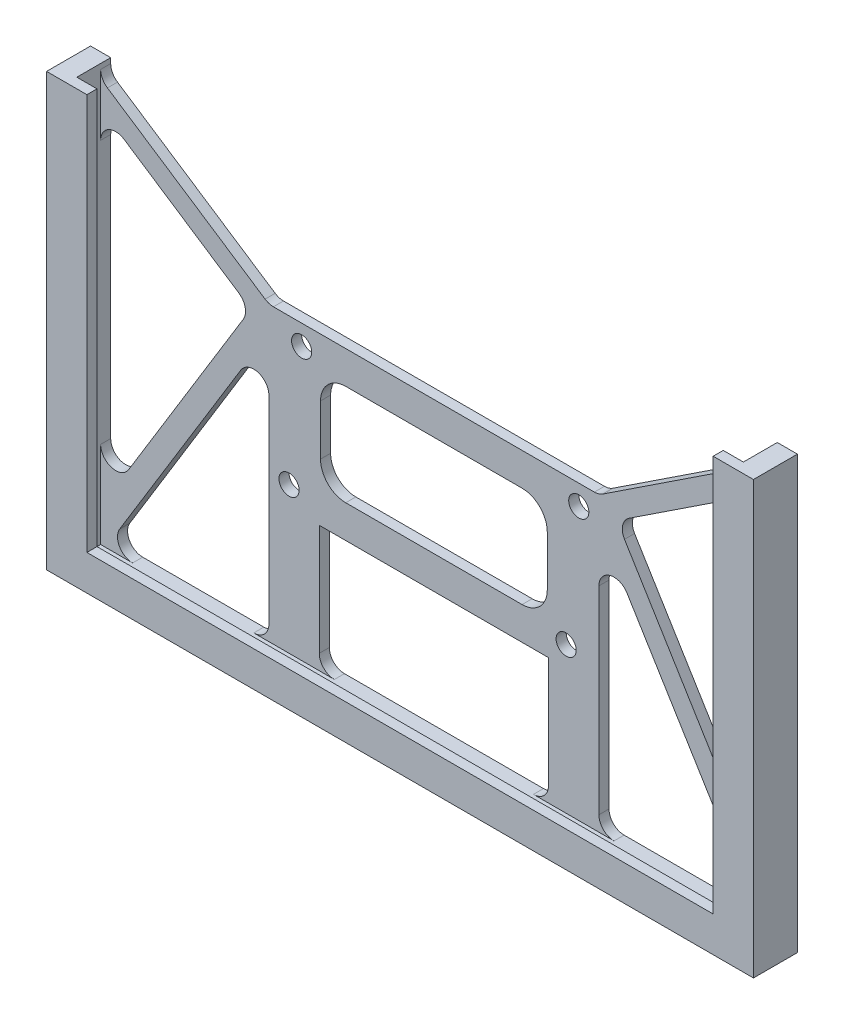
from build123d import *

# Parameters (mm, degrees)
SKETCH1_W                    = 83.185
SKETCH1_H                    = 41.91
SKETCH1_R                    = 2.54
SKETCH1_W_2                  = 57.15
SKETCH1_H_2                  = 25.4
ROVER_MOUNT_DEPTH            = 2.54
SIDE_WALLS_REACH             = 85.531
SIDE_WALLS_DIRECTION_2_DEPTH = 6.000000034
BACK_BRACES_DEPTH            = 2.54
FRONT_COVER_DEPTH            = 2.54
SKETCH5_W                    = 83.185
SKETCH5_H                    = 6.000000034
CLEANUP_DEPTH                = 31.75
FILLET1_R                    = 3.81
FILLET2_R                    = 6.35


with BuildPart() as part:
    # Sketch1 → Rover mount (new body)
    with BuildSketch(Plane.XY):
        with Locations((33.3375, -15.875)):
            Rectangle(SKETCH1_W, SKETCH1_H)
        with Locations((66.675, -31.75)):
            Circle(SKETCH1_R, mode=Mode.SUBTRACT)
        with Locations((69.85, 0)):
            Circle(SKETCH1_R, mode=Mode.SUBTRACT)
        with Locations((-3.175, -31.75)):
            Circle(SKETCH1_R, mode=Mode.SUBTRACT)
        Circle(SKETCH1_R, mode=Mode.SUBTRACT)
        with Locations((33.3375, -15.875)):
            Rectangle(SKETCH1_W_2, SKETCH1_H_2, mode=Mode.SUBTRACT)
    extrude(amount=ROVER_MOUNT_DEPTH)

    # Side Walls: up to this face of the body (flat: up to its plane)
    side_walls_end = Plane(part.part.faces().sort_by_distance((73.998539194, -15.875, 0))[0])
    # Sketch2 → Side Walls (add, up to the picked face)
    with BuildSketch(Plane.XY.offset(2.54), mode=Mode.PRIVATE) as side_walls_sk1:
        Polygon((-50.6625, -68.58), (-8.255, -68.58), (-8.255, -36.83), (4.445, -36.83), (4.445, -68.58), (62.23, -68.58), (62.23, -36.83), (74.93, -36.83), (74.93, -68.58), (117.3375, -68.58), (117.3375, 36.42), (122.4175, 36.42), (122.4175, -72.39), (-55.7425, -72.39), (-55.7425, 36.42), (-50.6625, 36.42), align=None)
    side_walls_tool1 = split(extrude(side_walls_sk1.sketch, amount=-SIDE_WALLS_REACH, mode=Mode.PRIVATE), bisect_by=side_walls_end, keep=Keep.BOTH, mode=Mode.PRIVATE)
    add(side_walls_tool1.solids().sort_by(Axis((-29.45875, -70.667597, 2.54), (0, 0, -1)))[0])

    # Sketch2 → Side Walls direction 2 (add)
    with BuildSketch(Plane.XY.offset(2.54)):
        Polygon((-50.6625, -68.58), (-8.255, -68.58), (-8.255, -36.83), (4.445, -36.83), (4.445, -68.58), (62.23, -68.58), (62.23, -36.83), (74.93, -36.83), (74.93, -68.58), (117.3375, -68.58), (117.3375, 36.42), (122.4175, 36.42), (122.4175, -72.39), (-55.7425, -72.39), (-55.7425, 36.42), (-50.6625, 36.42), align=None)
    extrude(amount=SIDE_WALLS_DIRECTION_2_DEPTH)

    # Sketch3 → Back Braces (add)
    with BuildSketch(Plane.XY.offset(2.54)):
        Polygon((-12.779899069, 1.716266635), (-55.7425, -68.58), (-49.3925, -68.58), (-8.255, -1.27), (-8.255, 5.08), (-55.7425, 36.42), (-55.7425, 30.07), align=None)
        Polygon((79.454899069, 1.716266635), (122.4175, -68.58), (116.0675, -68.58), (74.93, -1.27), (74.93, 5.08), (122.4175, 36.42), (122.4175, 30.07), align=None)
    extrude(amount=-BACK_BRACES_DEPTH)

    # Sketch4 → Front Cover (add)
    with BuildSketch(Plane.XY.offset(8.540000034)):
        Polygon((-55.7425, 36.42), (-45.5825, 36.42), (-45.5825, -63.5), (112.2575, -63.5), (112.2575, 36.42), (122.4175, 36.42), (122.4175, -72.39), (-55.7425, -72.39), align=None)
    extrude(amount=FRONT_COVER_DEPTH)

    # Sketch5 → Cleanup (cut)
    with BuildSketch(Plane(origin=(0, -36.83, 0), x_dir=(1, 0, 0), z_dir=(0, 1, 0))):
        with Locations((33.3375, -5.540000017)):
            Rectangle(SKETCH5_W, SKETCH5_H)
    extrude(amount=-CLEANUP_DEPTH, mode=Mode.SUBTRACT)

    # Fillet1
    fillet1_edges = [part.edges().sort_by_distance(p)[0] for p in [
        (117.3375, 26.717387207, 1.27),
        (117.3375, 33.067387207, 1.27),
        (117.3375, -60.268002431, 1.27),
        (79.454899069, 1.716266635, 1.27),
        (116.0675, -68.58, 1.27),
        (74.93, -1.27, 1.27),
        (-8.255, -68.58, 1.27),
        (4.445, -68.58, 1.27),
        (62.23, -68.58, 1.27),
        (74.93, -68.58, 1.27),
        (-8.255, 5.08, 1.27),
        (74.93, 5.08, 1.27),
        (-49.3925, -68.58, 1.27),
        (-12.779899069, 1.716266635, 1.27),
        (-50.6625, 33.067387207, 1.27),
        (-8.255, -1.27, 1.27),
        (-50.6625, -60.268002431, 1.27),
        (-50.6625, 26.717387207, 1.27),
    ]]
    fillet(fillet1_edges, radius=FILLET1_R)

    # Fillet2
    fillet2_edges = [part.edges().sort_by_distance(p)[0] for p in [
        (4.7625, -3.175, 1.27),
        (4.7625, -28.575, 1.27),
        (61.9125, -28.575, 1.27),
        (61.9125, -3.175, 1.27),
    ]]
    fillet(fillet2_edges, radius=FILLET2_R)


solid = part.part
